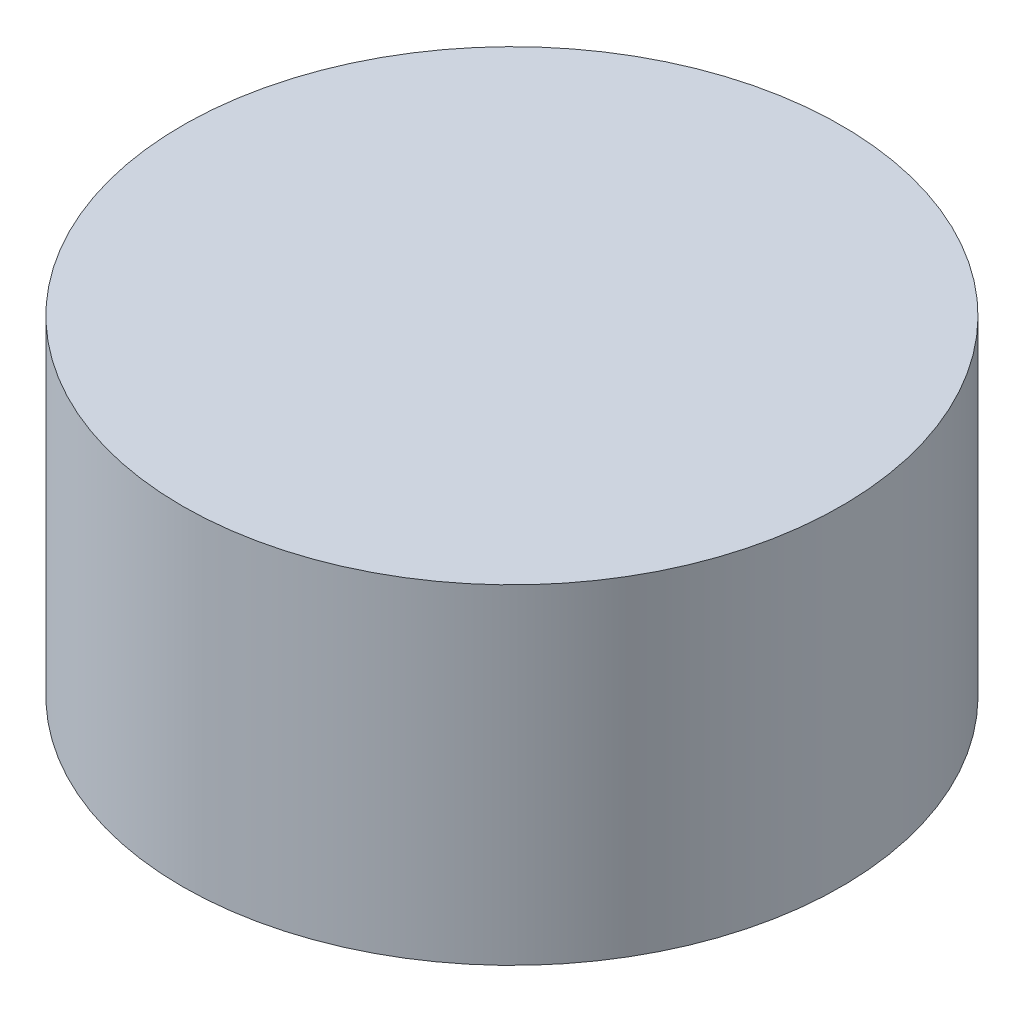
from build123d import *

# Parameters (mm, degrees)
SKETCH1_R           = 3
BOSS_EXTRUDE1_DEPTH = 3


with BuildPart() as part:
    # Sketch1 → Boss-Extrude1 (new body)
    with BuildSketch(Plane(origin=(0, 0, 0), x_dir=(1, 0, 0), z_dir=(0, 1, 0))):
        with Locations(Location((0, 0, 0), (0, 0, 270))):
            Circle(SKETCH1_R)
    extrude(amount=BOSS_EXTRUDE1_DEPTH)


solid = part.part
